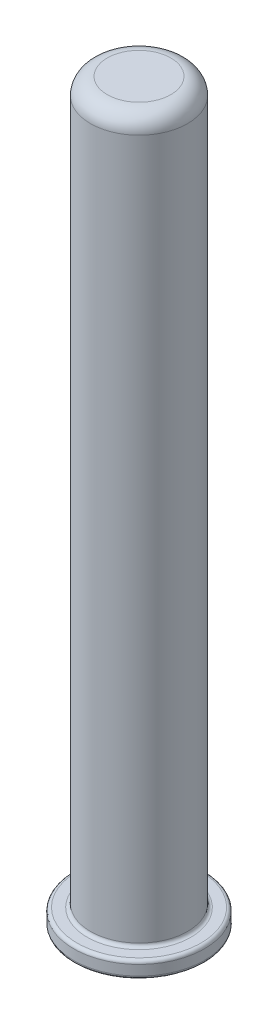
from build123d import *

# Parameters (mm, degrees)
SKETCH2_R           = 14.5
BOSS_EXTRUDE1_DEPTH = 220
FILLET1_R           = 5
SKETCH3_R           = 19.5
BOSS_EXTRUDE2_DEPTH = 5
FILLET2_R           = 1


with BuildPart() as part:
    # Sketch2 → Boss-Extrude1 (new body)
    with BuildSketch(Plane(origin=(0, 0, 0), x_dir=(1, 0, 0), z_dir=(0, 1, 0))):
        with Locations(Location((0, 0, 0), (0, 0, 270))):
            Circle(SKETCH2_R)
    extrude(amount=BOSS_EXTRUDE1_DEPTH)

    # Fillet1
    fillet1_edges = [part.edges().sort_by_distance(p)[0] for p in [
        (0, 220, -14.5),
    ]]
    fillet(fillet1_edges, radius=FILLET1_R)

    # Sketch3 → Boss-Extrude2 (add)
    with BuildSketch(Plane.XZ):
        with Locations(Location((0, 0, 0), (0, 0, 270))):
            Circle(SKETCH3_R)
    extrude(amount=-BOSS_EXTRUDE2_DEPTH)

    # Fillet2
    fillet2_edges = [part.edges().sort_by_distance(p)[0] for p in [
        (0, 5, 19.5),
        (0, 0, 19.5),
        (0, 5, -14.5),
    ]]
    fillet(fillet2_edges, radius=FILLET2_R)


solid = part.part
